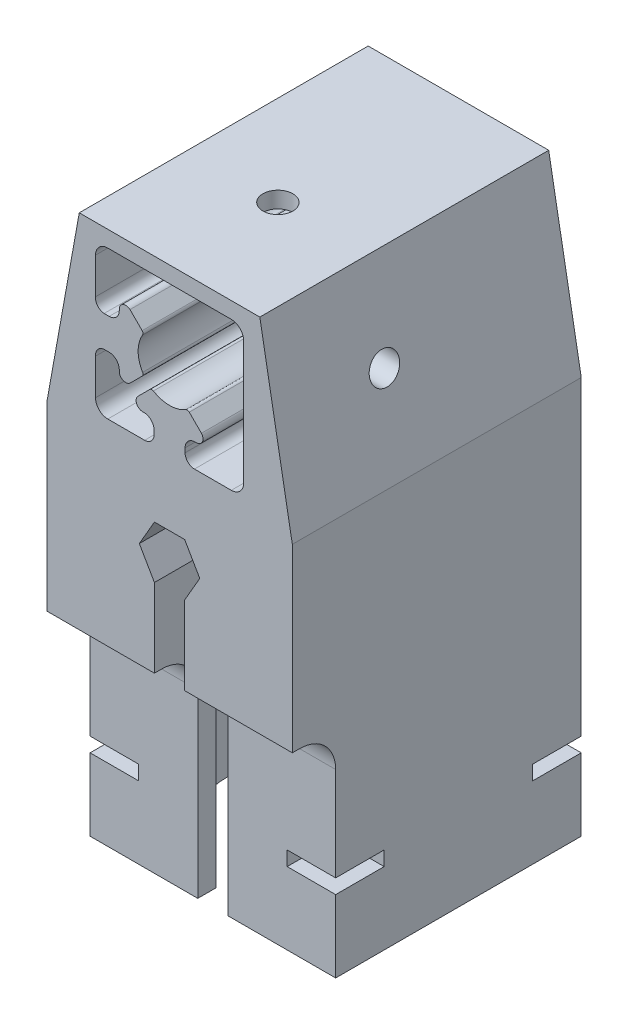
from build123d import *

# Parameters (mm, degrees)
BOSS_EXTRUDE1_DEPTH = 80
SKETCH2_W           = 68
SKETCH2_H           = 12
CUT_EXTRUDE1_DEPTH  = 60
FILLET1_R           = 10
CUT_EXTRUDE6_DEPTH  = 60
SKETCH6_R           = 29.25
CUT_EXTRUDE7_DEPTH  = 95
SKETCH7_R           = 3
CUT_EXTRUDE8_DEPTH  = 41
CUT_EXTRUDE9_START  = -20
CUT_EXTRUDE9_DEPTH  = 4
CUT_EXTRUDE10_DEPTH = 30
CUT_EXTRUDE11_START = -90
CUT_EXTRUDE11_DEPTH = 90
SKETCH11_R          = 4.15
CUT_EXTRUDE12_DEPTH = 18
SKETCH12_R          = 4.15
CUT_EXTRUDE13_DEPTH = 18


with BuildPart() as part:
    # Sketch1 → Boss-Extrude1 (new body)
    with BuildSketch(Plane.XY):
        Polygon((25, 0), (-25, 0), (-34, -50), (-34, -160), (34, -160), (34, -50), align=None)
    extrude(amount=BOSS_EXTRUDE1_DEPTH)

    # Sketch2 → Cut-Extrude1 (cut)
    with BuildSketch(Plane.XZ.offset(160)):
        with Locations((0, 74)):
            Rectangle(SKETCH2_W, SKETCH2_H)
    extrude(amount=-CUT_EXTRUDE1_DEPTH, mode=Mode.SUBTRACT)

    # Fillet1
    fillet1_edges = [part.edges().sort_by_distance(p)[0] for p in [
        (0, -100, 68),
    ]]
    fillet(fillet1_edges, radius=FILLET1_R)

    # Sketch5 → Cut-Extrude6 (cut)
    with BuildSketch(Plane.XY.offset(80)):
        with BuildLine():
            Line((17.1, -45.5), (6.9, -45.5))
            ThreePointArc((6.9, -45.5), (5.061522369, -44.738477631), (4.3, -42.9))
            Line((4.3, -42.9), (4.3, -41.72))
            ThreePointArc((4.3, -41.72), (5.120101013, -39.740101013), (7.1, -38.92))
            Line((7.1, -38.92), (7.460539391, -38.92))
            ThreePointArc((7.460539391, -38.92), (9.09596662, -37.871916072), (8.826877189, -35.948197533))
            Line((8.826877189, -35.948197533), (5.457008123, -32.578328466))
            ThreePointArc((5.457008123, -32.578328466), (4.988893203, -32.349986186), (4.479421839, -32.458202195))
            ThreePointArc((4.479421839, -32.458202195), (0, -33.7), (-4.479421839, -32.458202195))
            ThreePointArc((-4.479421839, -32.458202195), (-4.988893203, -32.349986186), (-5.457008123, -32.578328466))
            Line((-5.457008123, -32.578328466), (-8.826877189, -35.948197533))
            ThreePointArc((-8.826877189, -35.948197533), (-9.09596662, -37.871916072), (-7.460539391, -38.92))
            Line((-7.460539391, -38.92), (-7.1, -38.92))
            ThreePointArc((-7.1, -38.92), (-5.120101013, -39.740101013), (-4.3, -41.72))
            Line((-4.3, -41.72), (-4.3, -42.9))
            ThreePointArc((-4.3, -42.9), (-5.061522369, -44.738477631), (-6.9, -45.5))
            Line((-6.9, -45.5), (-17.1, -45.5))
            ThreePointArc((-17.1, -45.5), (-19.504163056, -44.504163056), (-20.5, -42.1))
            Line((-20.5, -42.1), (-20.5, -32.118179099))
            ThreePointArc((-20.5, -32.118179099), (-19.895099696, -30.212814465), (-18.116592311, -29.3))
            Line((-18.116592311, -29.3), (-16.72, -29.3))
            ThreePointArc((-16.72, -29.3), (-14.740101013, -30.120101013), (-13.92, -32.1))
            Line((-13.92, -32.1), (-13.92, -32.460539391))
            ThreePointArc((-13.92, -32.460539391), (-12.871916072, -34.09596662), (-10.948197533, -33.826877189))
            Line((-10.948197533, -33.826877189), (-7.578328467, -30.457008123))
            ThreePointArc((-7.578328467, -30.457008123), (-7.349986186, -29.988893203), (-7.458202195, -29.479421839))
            ThreePointArc((-7.458202195, -29.479421839), (-8.7, -25), (-7.458202195, -20.520578161))
            ThreePointArc((-7.458202195, -20.520578161), (-7.349986186, -20.011106797), (-7.578328467, -19.542991877))
            Line((-7.578328467, -19.542991877), (-10.948197533, -16.173122811))
            ThreePointArc((-10.948197533, -16.173122811), (-12.871916072, -15.90403338), (-13.92, -17.539460609))
            Line((-13.92, -17.539460609), (-13.92, -17.9))
            ThreePointArc((-13.92, -17.9), (-14.740101013, -19.879898987), (-16.72, -20.7))
            Line((-16.72, -20.7), (-18.116592311, -20.7))
            ThreePointArc((-18.116592311, -20.7), (-19.895099696, -19.787185535), (-20.5, -17.881820901))
            Line((-20.5, -17.881820901), (-20.5, -7.9))
            ThreePointArc((-20.5, -7.9), (-19.504163056, -5.495836944), (-17.1, -4.5))
            Line((-17.1, -4.5), (-7.1, -4.5))
            Line((-7.1, -4.5), (7.1, -4.5))
            Line((7.1, -4.5), (17.1, -4.5))
            ThreePointArc((17.1, -4.5), (19.504163056, -5.495836944), (20.5, -7.9))
            Line((20.5, -7.9), (20.5, -18.1))
            Line((20.5, -18.1), (20.5, -31.9))
            Line((20.5, -31.9), (20.5, -42.1))
            ThreePointArc((20.5, -42.1), (19.504163056, -44.504163056), (17.1, -45.5))
        make_face()
    extrude(amount=-CUT_EXTRUDE6_DEPTH, mode=Mode.SUBTRACT)

    # Sketch6 → Cut-Extrude7 (cut)
    with BuildSketch(Plane.XZ.offset(160)):
        with Locations(Location((0, 34, 0), (0, 0, 270))):
            Circle(SKETCH6_R)
    extrude(amount=-CUT_EXTRUDE7_DEPTH, mode=Mode.SUBTRACT)

    # Sketch7 → Cut-Extrude8 (cut)
    with BuildSketch(Plane.XZ.offset(160)):
        with Locations(Location((-23.511300474, 57.511300474, 0), (0, 0, 270))):
            Circle(SKETCH7_R)
        with Locations(Location((23.511300474, 57.511300474, 0), (0, 0, 270))):
            Circle(SKETCH7_R)
        with Locations(Location((23.511300474, 10.488699526, 0), (0, 0, 270))):
            Circle(SKETCH7_R)
        with Locations(Location((-23.511300474, 10.488699526, 0), (0, 0, 270))):
            Circle(SKETCH7_R)
    extrude(amount=-CUT_EXTRUDE8_DEPTH, mode=Mode.SUBTRACT)

    # Sketch8 → Cut-Extrude9 (cut)
    with BuildSketch(Plane.XZ.offset(160).offset(CUT_EXTRUDE9_START)):
        Polygon((-26.450688166, 54.571912783), (-22.435409908, 53.496022217), (-19.496022217, 56.435409908), (-20.571912783, 60.450688166), (-20.571912783, 68), (-34, 68), (-34, 54.571912783), align=None)
        Polygon((20.571912783, 60.450688166), (19.496022217, 56.435409908), (22.435409908, 53.496022217), (26.450688166, 54.571912783), (34, 54.571912783), (34, 68), (20.571912783, 68), align=None)
        Polygon((26.450688166, 13.428087217), (22.435409908, 14.503977783), (19.496022217, 11.564590092), (20.571912783, 7.549311834), (20.571912783, 0), (34, 0), (34, 13.428087217), align=None)
        Polygon((-20.571912783, 7.549311834), (-19.496022217, 11.564590092), (-22.435409908, 14.503977783), (-26.450688166, 13.428087217), (-34, 13.428087217), (-34, 0), (-20.571912783, 0), align=None)
    extrude(amount=-CUT_EXTRUDE9_DEPTH, mode=Mode.SUBTRACT)

    # Sketch9 → Cut-Extrude10 (cut)
    with BuildSketch(Plane.XY.offset(80)):
        Polygon((4.185789452, -63.75), (-4.185789452, -63.75), (-8.371578903, -71), (-4.185789452, -78.25), (4.185789452, -78.25), (8.371578903, -71), align=None)
    extrude(amount=-CUT_EXTRUDE10_DEPTH, mode=Mode.SUBTRACT)

    # Sketch10 → Cut-Extrude11 (cut)
    with BuildSketch(Plane(origin=(0, -78.25, 0), x_dir=(1, 0, 0), z_dir=(0, 1, 0)).offset(CUT_EXTRUDE11_START)):
        with BuildLine():
            Line((-4.185789452, -62.948949319), (-4.185789452, -80))
            Line((-4.185789452, -80), (4.185789452, -80))
            Line((4.185789452, -80), (4.185789452, -62.948949319))
            ThreePointArc((4.185789452, -62.948949319), (0, -63.25), (-4.185789452, -62.948949319))
        make_face()
    extrude(amount=CUT_EXTRUDE11_DEPTH, mode=Mode.SUBTRACT)

    # Sketch11 → Cut-Extrude12 (cut)
    with BuildSketch(Plane(origin=(0, 0, 0), x_dir=(1, 0, 0), z_dir=(0, 1, 0))):
        with Locations(Location((0, -50, 0), (0, 0, 180))):
            Circle(SKETCH11_R)
    extrude(amount=-CUT_EXTRUDE12_DEPTH, mode=Mode.SUBTRACT)

    # Sketch12 → Cut-Extrude13 (cut)
    with BuildSketch(Plane.ZY.offset(-20.5)):
        with Locations((50, -25)):
            Circle(SKETCH12_R)
    extrude(amount=-CUT_EXTRUDE13_DEPTH, mode=Mode.SUBTRACT)


solid = part.part
